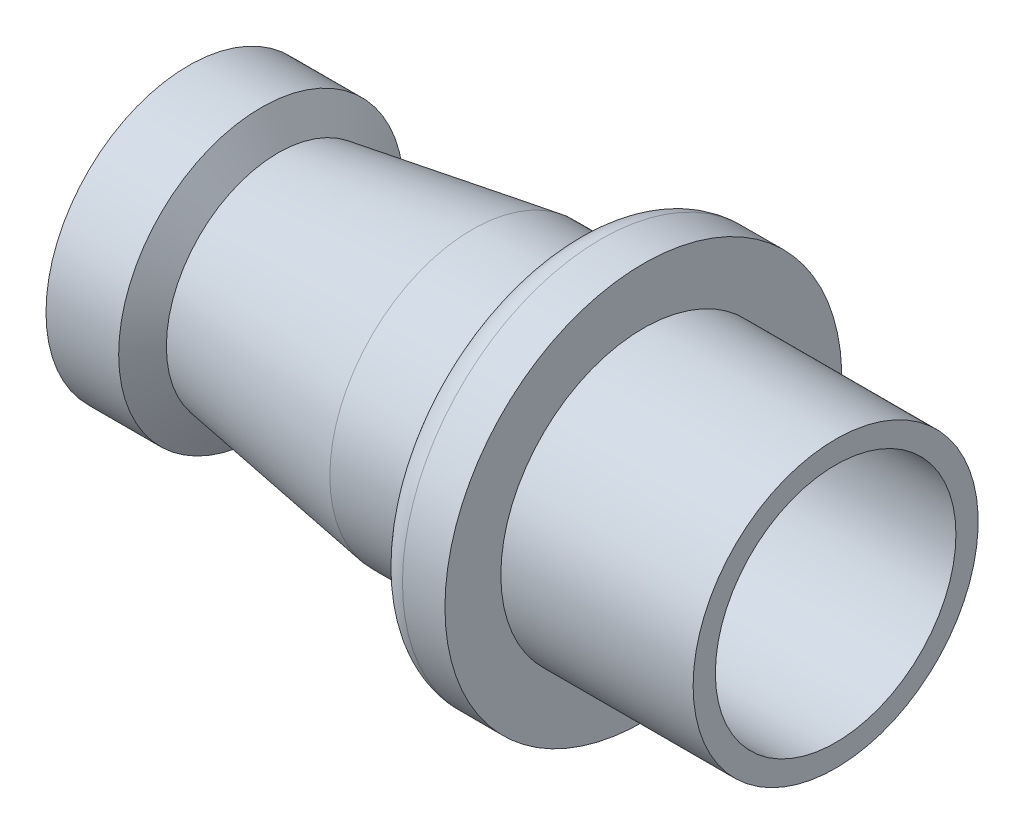
from build123d import *

# Parameters (mm, degrees)
FILLET2_R = 0.127


with BuildPart() as part:
    # Sketch1 → Revolve1 (revolve)
    with BuildSketch(Plane.XY, mode=Mode.PRIVATE) as revolve1_sk:
        Polygon((88.476526811, 146.943032749), (88.898166811, 146.943032749), (88.961666811, 147.197032749), (89.253766811, 147.197032749), (89.253766811, 146.943032749), (90.127526811, 146.943032749), (90.127526811, 146.841971125), (88.628926811, 146.841971125), (88.628926811, 146.714971125), (87.186879843, 146.714971125), (87.186879843, 146.943032749), (87.517079843, 146.943032749), (87.594159764, 146.803332749), align=None)
    revolve(revolve1_sk.sketch.rotate(Axis((82.894279843, 146.295332749, 0), (1, 0, 0)), 90), axis=Axis((82.894279843, 146.295332749, 0), (1, 0, 0)))

    # Fillet2
    fillet2_edges = [part.edges().sort_by_distance(p)[0] for p in [
        (88.961666811, 146.295332749, -0.9017),
    ]]
    fillet(fillet2_edges, radius=FILLET2_R)


solid = part.part
